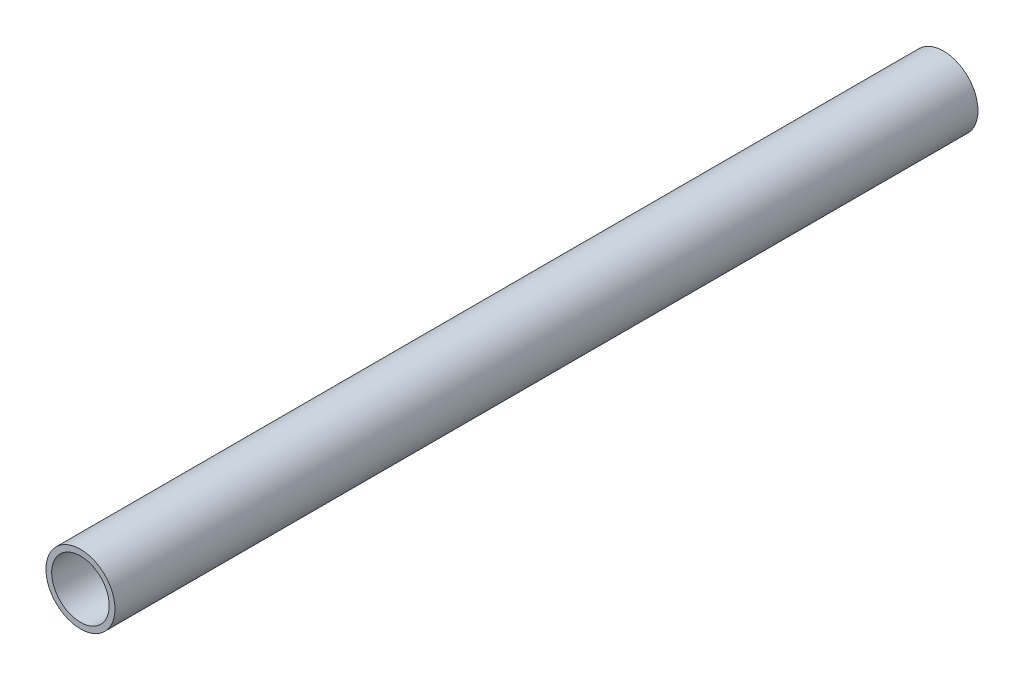
from build123d import *

# Parameters (mm, degrees)
SKETCH_1_R      = 6
SKETCH_1_R_2    = 5
EXTRUDE_1_DEPTH = 150


with BuildPart() as part:
    # 草图1 → 凸台-拉伸1 (new body)
    with BuildSketch(Plane.XY):
        Circle(SKETCH_1_R)
        Circle(SKETCH_1_R_2, mode=Mode.SUBTRACT)
    extrude(amount=EXTRUDE_1_DEPTH)


solid = part.part
